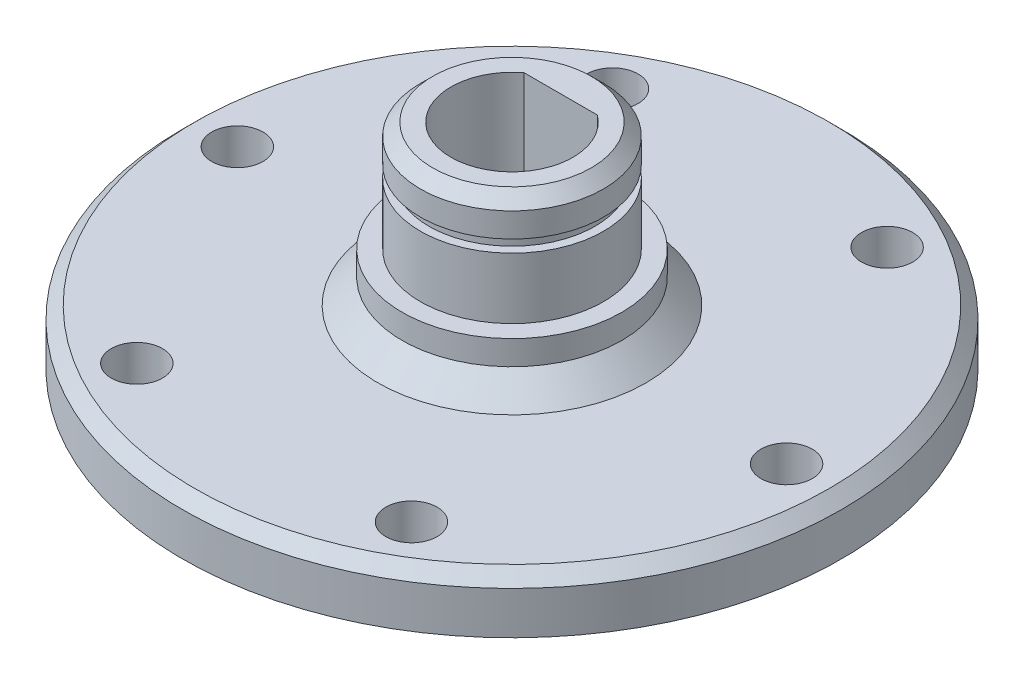
from build123d import *

# Parameters (mm, degrees)
CUT_EXTRUDE_1_DEPTH = 43.649736224
HOLE_WIZARD_M5_1_D  = 4.2
CHAMFER_1_SIZE      = 2
CHAMFER_2_SIZE      = 1


with BuildPart() as part:
    # 草图1 → 旋转1 (revolve)
    with BuildSketch(Plane.XY, mode=Mode.PRIVATE) as revolve_1_sk:
        Polygon((0, 19), (0, 0), (10, 0), (10, 1.5), (27, 1.5), (27, 6), (9, 6), (9, 10), (7.5, 10), (7.5, 15), (6.8, 15), (6.8, 16), (7.5, 16), (7.5, 19), align=None)
    revolve(revolve_1_sk.sketch.rotate(Axis((0, 19, 0), (0, -1, 0)), 180), axis=Axis((0, 19, 0), (0, -1, 0)))

    # 草图2 → 切除-拉伸1 (cut, through all)
    with BuildSketch(Plane(origin=(0, 19, 0), x_dir=(1, 0, 0), z_dir=(0, 1, 0))):
        with BuildLine():
            Line((-3, 4), (3, 4))
            ThreePointArc((3, 4), (0, -5), (-3, 4))
        make_face()
    extrude(amount=-CUT_EXTRUDE_1_DEPTH, mode=Mode.SUBTRACT)

    # M5 螺纹孔1 (through all)
    with Locations(Plane(origin=(0, 6, 0), x_dir=(1, 0, 0), z_dir=(0, 1, 0))):
        with Locations((-11.25, 19.485571585), (11.25, 19.485571585), (22.5, 0), (11.25, -19.485571585), (-11.25, -19.485571585), (-22.5, 0)):
            Hole(HOLE_WIZARD_M5_1_D / 2)

    # 倒角1
    chamfer_1_edges = [part.edges().sort_by_distance(p)[0] for p in [
        (9, 6, 0),
    ]]
    chamfer(chamfer_1_edges, length=CHAMFER_1_SIZE)

    # 倒角2
    chamfer_2_edges = [part.edges().sort_by_distance(p)[0] for p in [
        (27, 6, 0),
        (7.5, 19, 0),
    ]]
    chamfer(chamfer_2_edges, length=CHAMFER_2_SIZE)


solid = part.part
